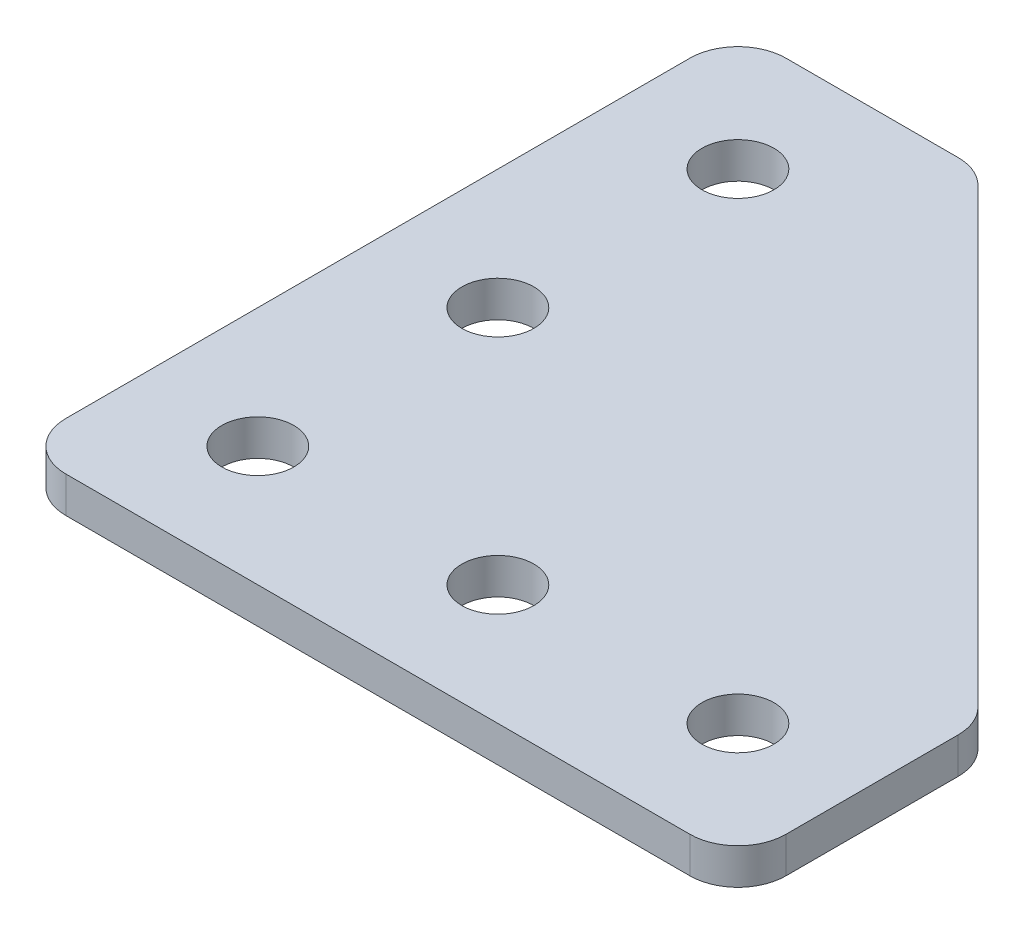
from build123d import *

# Parameters (mm, degrees)
SKETCH_2_R      = 1.5
EXTRUDE_1_DEPTH = 1.5
FILLET_1_R      = 2


with BuildPart() as part:
    # ｽｹｯﾁ2 → ﾎﾞｽ - 押し出し1 (new body)
    with BuildSketch(Plane(origin=(0, 0, 0), x_dir=(1, 0, 0), z_dir=(0, 1, 0))):
        Polygon((0, 0), (30, 0), (30, 10), (10, 30), (0, 30), align=None)
        with Locations(Location((5, 5, 0), (0, 0, 270))):
            Circle(SKETCH_2_R, mode=Mode.SUBTRACT)
        with Locations(Location((25, 5, 0), (0, 0, 270))):
            Circle(SKETCH_2_R, mode=Mode.SUBTRACT)
        with Locations(Location((5, 25, 0), (0, 0, 90))):
            Circle(SKETCH_2_R, mode=Mode.SUBTRACT)
        with Locations(Location((15, 5, 0), (0, 0, 270))):
            Circle(SKETCH_2_R, mode=Mode.SUBTRACT)
        with Locations(Location((5, 15, 0), (0, 0, 270))):
            Circle(SKETCH_2_R, mode=Mode.SUBTRACT)
    extrude(amount=EXTRUDE_1_DEPTH)

    # ﾌｨﾚｯﾄ1
    fillet_1_edges = [part.edges().sort_by_distance(p)[0] for p in [
        (0, 0.75, -30),
        (10, 0.75, -30),
        (30, 0.75, -10),
        (30, 0.75, 0),
        (0, 0.75, 0),
    ]]
    fillet(fillet_1_edges, radius=FILLET_1_R)


solid = part.part
